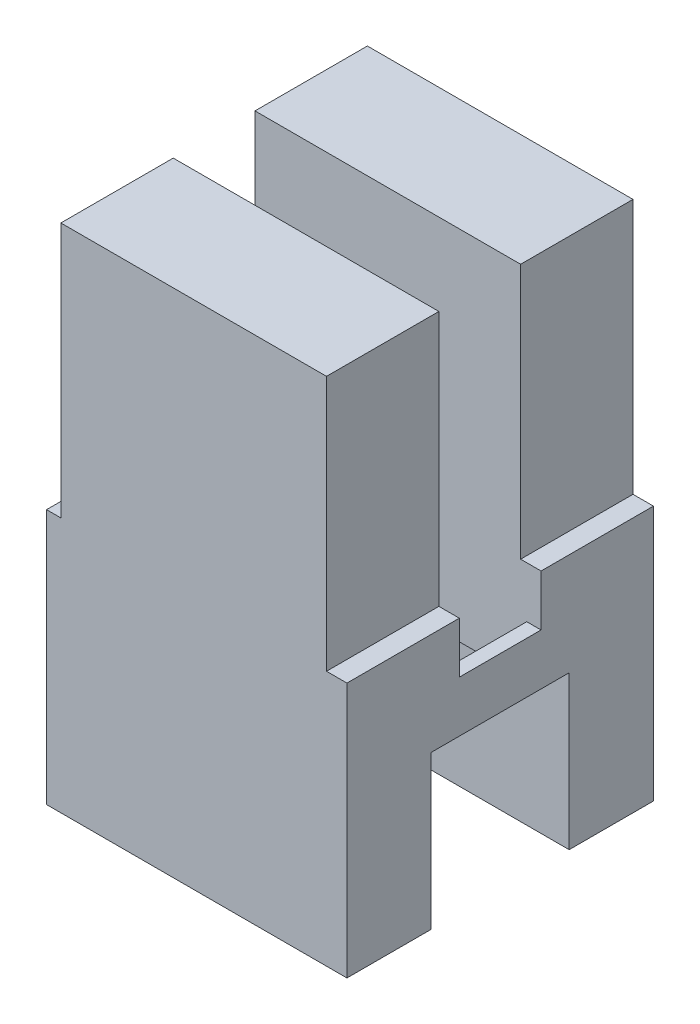
from build123d import *

# Parameters (mm, degrees)
SKETCH1_W           = 37.338
SKETCH1_H           = 38.1
BOSS_EXTRUDE1_DEPTH = 63.5
SKETCH3_W           = 37.338
SKETCH3_H           = 10.16
CUT_EXTRUDE1_DEPTH  = 38.1
SKETCH4_W           = 37.338
SKETCH4_H           = 17.145
CUT_EXTRUDE2_DEPTH  = 19.05
SKETCH5_W           = 33.782
SKETCH5_H           = 10.16
CUT_EXTRUDE3_DEPTH  = 47.508537507
SKETCH6_W           = 2.54
SKETCH6_H           = 38.1
SKETCH6_W_2         = 1.778
CUT_EXTRUDE4_DEPTH  = 31.75


with BuildPart() as part:
    # Sketch1 → Boss-Extrude1 (new body)
    with BuildSketch(Plane(origin=(0, 0, 0), x_dir=(1, 0, 0), z_dir=(0, 1, 0))):
        Rectangle(SKETCH1_W, SKETCH1_H)
    extrude(amount=BOSS_EXTRUDE1_DEPTH)

    # Sketch3 → Cut-Extrude1 (cut)
    with BuildSketch(Plane(origin=(0, 63.5, 0), x_dir=(1, 0, 0), z_dir=(0, 1, 0))):
        Rectangle(SKETCH3_W, SKETCH3_H)
    extrude(amount=-CUT_EXTRUDE1_DEPTH, mode=Mode.SUBTRACT)

    # Sketch4 → Cut-Extrude2 (cut)
    with BuildSketch(Plane.XZ):
        Rectangle(SKETCH4_W, SKETCH4_H)
    extrude(amount=-CUT_EXTRUDE2_DEPTH, mode=Mode.SUBTRACT)

    # Sketch5 → Cut-Extrude3 (cut, through all)
    with BuildSketch(Plane(origin=(0, 25.4, 0), x_dir=(1, 0, 0), z_dir=(0, 1, 0))):
        Rectangle(SKETCH5_W, SKETCH5_H)
    extrude(amount=-CUT_EXTRUDE3_DEPTH, mode=Mode.SUBTRACT)

    # Sketch6 → Cut-Extrude4 (cut)
    with BuildSketch(Plane(origin=(0, 63.5, 0), x_dir=(1, 0, 0), z_dir=(0, 1, 0))):
        with Locations((17.399, 0)):
            Rectangle(SKETCH6_W, SKETCH6_H)
        with Locations((-17.78, 0)):
            Rectangle(SKETCH6_W_2, SKETCH6_H)
    extrude(amount=-CUT_EXTRUDE4_DEPTH, mode=Mode.SUBTRACT)


solid = part.part
